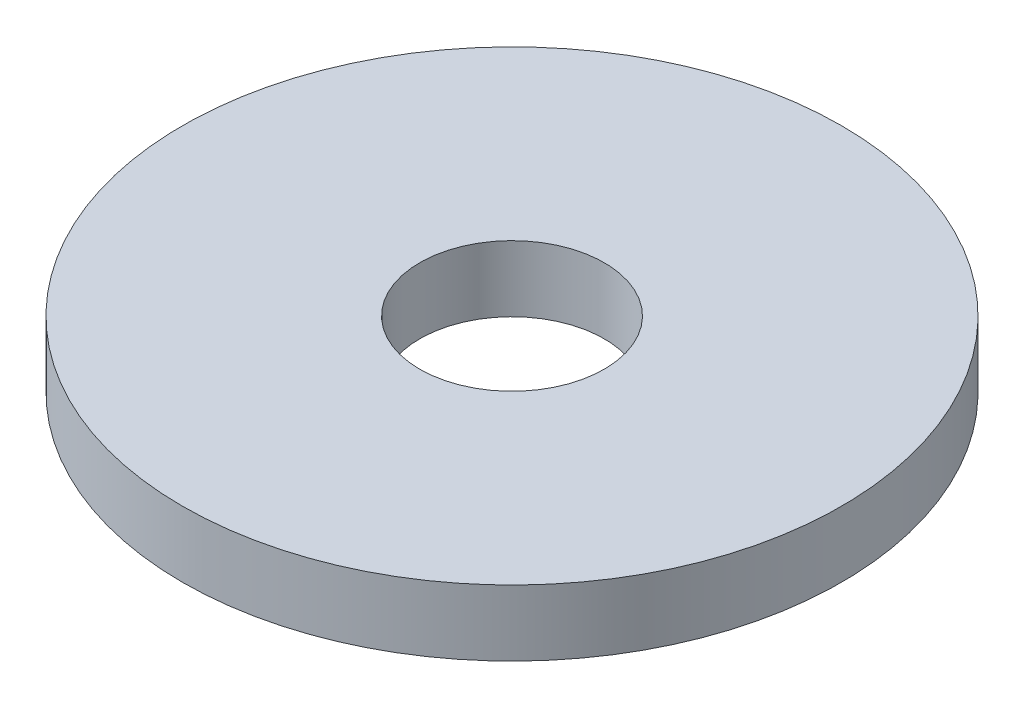
from build123d import *

# Parameters (mm, degrees)
SKETCH_1_R      = 25
SKETCH_1_R_2    = 7
EXTRUDE_1_DEPTH = 5


with BuildPart() as part:
    # Эскиз1 → Бобышка-Вытянуть1 (new body)
    with BuildSketch(Plane(origin=(0, 0, 0), x_dir=(1, 0, 0), z_dir=(0, 1, 0))):
        with Locations(Location((0, 0, 0), (0, 0, 270))):
            Circle(SKETCH_1_R)
        with Locations(Location((0, 0, 0), (0, 0, 270))):
            Circle(SKETCH_1_R_2, mode=Mode.SUBTRACT)
    extrude(amount=EXTRUDE_1_DEPTH)


solid = part.part
